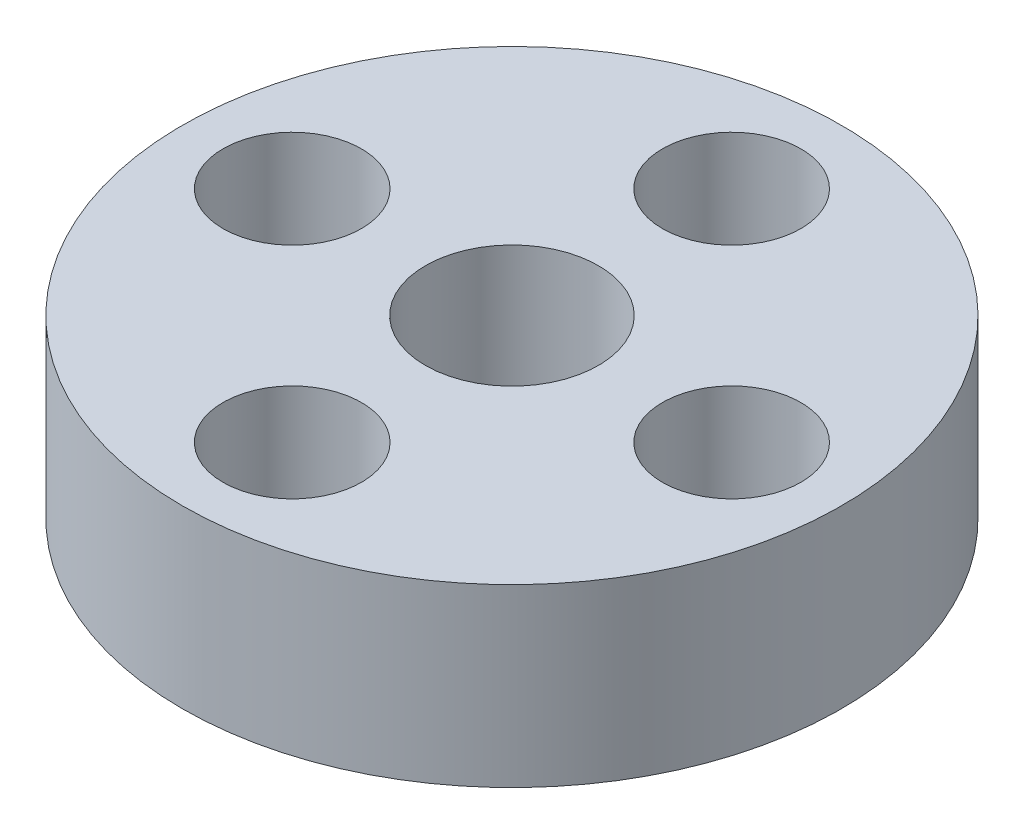
from build123d import *

# Parameters (mm, degrees)
ESQUISSE1_R             = 9.525
BOSS_EXTRU_1_DEPTH      = 5.08
ESQUISSE2_R             = 2
ESQUISSE2_R_2           = 2.5
ENL_V_MAT_EXTRU_1_DEPTH = 15.396445742


with BuildPart() as part:
    # Esquisse1 → Boss.-Extru.1 (new body)
    with BuildSketch(Plane(origin=(0, 0, 0), x_dir=(1, 0, 0), z_dir=(0, 1, 0))):
        with Locations(Location((0, 0, 0), (0, 0, 270))):
            Circle(ESQUISSE1_R)
    extrude(amount=BOSS_EXTRU_1_DEPTH)

    # Esquisse2 → Enlèv. mat.-Extru.1 (cut, through all)
    with BuildSketch(Plane(origin=(0, 5.08, 0), x_dir=(1, 0, 0), z_dir=(0, 1, 0))):
        with Locations(Location((0, 6.35, 0), (0, 0, 270))):
            Circle(ESQUISSE2_R)
        with Locations(Location((-6.35, 0, 0), (0, 0, 270))):
            Circle(ESQUISSE2_R)
        with Locations(Location((6.35, 0, 0), (0, 0, 270))):
            Circle(ESQUISSE2_R)
        with Locations(Location((0, -6.35, 0), (0, 0, 270))):
            Circle(ESQUISSE2_R)
        with Locations(Location((0, 0, 0), (0, 0, 270))):
            Circle(ESQUISSE2_R_2)
    extrude(amount=-ENL_V_MAT_EXTRU_1_DEPTH, mode=Mode.SUBTRACT)


solid = part.part
